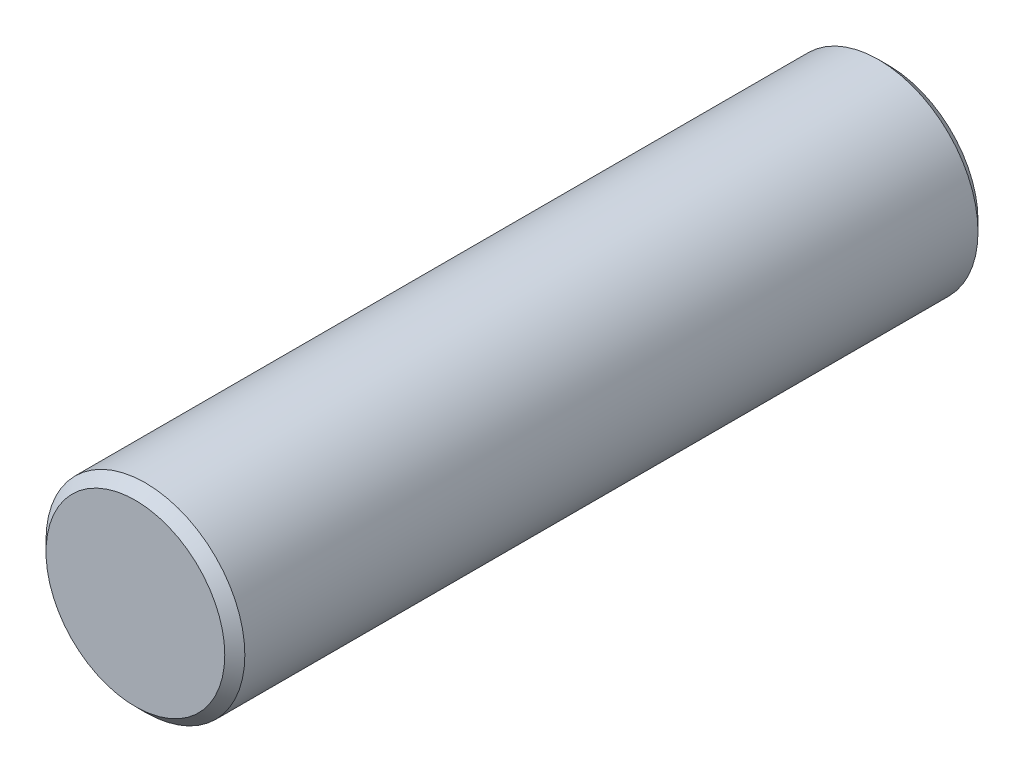
from build123d import *

# Parameters (mm, degrees)
SKETCH1_R           = 9.9
BOSS_EXTRUDE1_DEPTH = 75
CHAMFER1_SIZE       = 1
CHAMFER2_SIZE       = 1


with BuildPart() as part:
    # Sketch1 → Boss-Extrude1 (new body)
    with BuildSketch(Plane.XY):
        Circle(SKETCH1_R)
    extrude(amount=BOSS_EXTRUDE1_DEPTH)

    # Chamfer1
    chamfer1_edges = [part.edges().sort_by_distance(p)[0] for p in [
        (-9.9, 0, 0),
    ]]
    chamfer(chamfer1_edges, length=CHAMFER1_SIZE)

    # Chamfer2
    chamfer2_edges = [part.edges().sort_by_distance(p)[0] for p in [
        (-9.9, 0, 75),
    ]]
    chamfer(chamfer2_edges, length=CHAMFER2_SIZE)


solid = part.part
